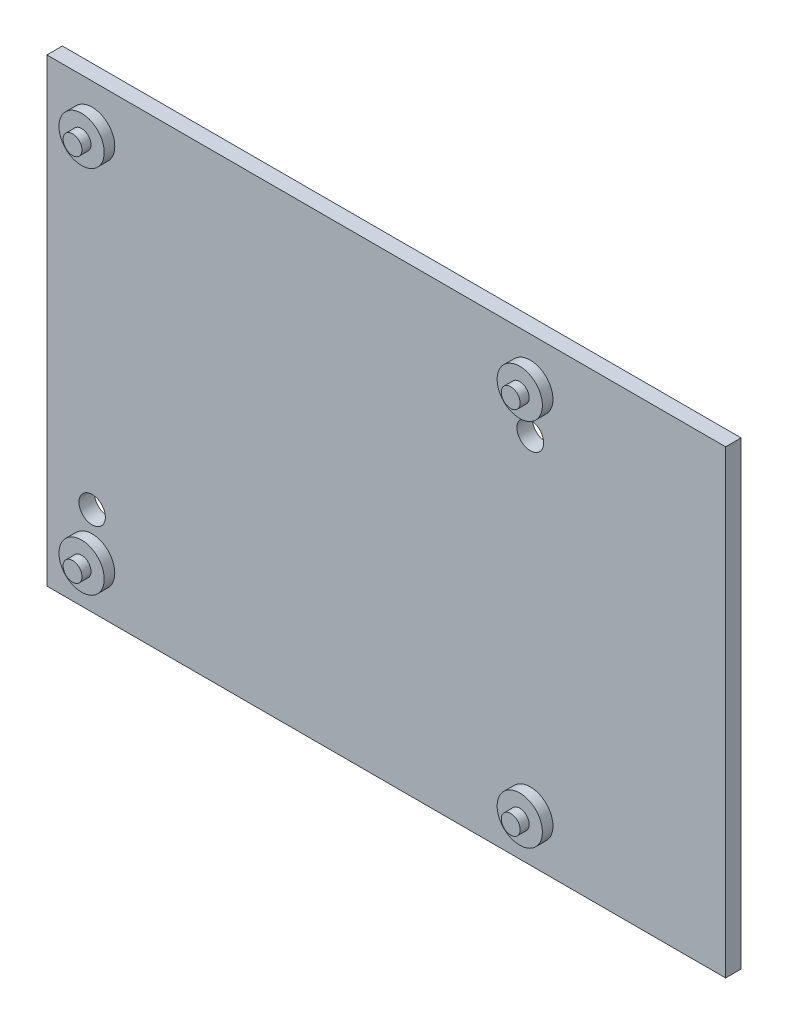
from build123d import *

# Parameters (mm, degrees)
BASE_W                       = 90
BASE_H                       = 61
BASE_BLOCK_DEPTH             = 2.05
OUTER_PIN_STAND_DEPTH        = 1.4
OUTER_PIN_STAND_DEPTH_BACK   = 0.5
OUTER_PIN_R                  = 3
OUTER_PIN_STAND_2_DEPTH      = 1.4
OUTER_PIN_STAND_2_DEPTH_BACK = 0.5
OUTER_PIN_STAND_3_DEPTH      = 1.4
OUTER_PIN_STAND_3_DEPTH_BACK = 0.5
OUTER_PIN_STAND_4_DEPTH      = 1.4
OUTER_PIN_STAND_4_DEPTH_BACK = 0.5
INNER_PIN_STAND_DEPTH        = 2.6
INNER_PIN_STAND_DEPTH_BACK   = 0.5
SKETCH3_R                    = 1.25
INNER_PIN_STAND_2_DEPTH      = 2.6
INNER_PIN_STAND_2_DEPTH_BACK = 0.5
INNER_PIN_STAND_3_DEPTH      = 2.6
INNER_PIN_STAND_3_DEPTH_BACK = 0.5
INNER_PIN_STAND_4_DEPTH      = 2.6
INNER_PIN_STAND_4_DEPTH_BACK = 0.5
HOLES_DEPTH                  = 5
HOLES_DEPTH_BACK             = 5
SKETCH5_R                    = 1.75
HOLES_2_DEPTH                = 5
HOLES_2_DEPTH_BACK           = 5
SKETCH5_R_2                  = 1.775


with BuildPart() as part:
    # Base → Base Block (new body)
    with BuildSketch(Plane.XY):
        Rectangle(BASE_W, BASE_H)
    extrude(amount=-BASE_BLOCK_DEPTH)


with BuildPart() as body_2:
    # Outer Pin → Outer Pin Stand (new, two sides: drawn at the far end of the back side and taken through both)
    with BuildSketch(Plane.XY.offset(-OUTER_PIN_STAND_DEPTH_BACK)):
        with Locations((-39, 24.5)):
            Circle(OUTER_PIN_R)
    extrude(amount=OUTER_PIN_STAND_DEPTH + OUTER_PIN_STAND_DEPTH_BACK)


with BuildPart() as body_3:
    # Outer Pin → Outer Pin Stand 2 (new, two sides: drawn at the far end of the back side and taken through both)
    with BuildSketch(Plane.XY.offset(-OUTER_PIN_STAND_2_DEPTH_BACK)):
        with Locations((-39, -24.5)):
            Circle(OUTER_PIN_R)
    extrude(amount=OUTER_PIN_STAND_2_DEPTH + OUTER_PIN_STAND_2_DEPTH_BACK)


with BuildPart() as body_4:
    # Outer Pin → Outer Pin Stand 3 (new, two sides: drawn at the far end of the back side and taken through both)
    with BuildSketch(Plane.XY.offset(-OUTER_PIN_STAND_3_DEPTH_BACK)):
        with Locations((19.1, -24.5)):
            Circle(OUTER_PIN_R)
    extrude(amount=OUTER_PIN_STAND_3_DEPTH + OUTER_PIN_STAND_3_DEPTH_BACK)


with BuildPart() as body_5:
    # Outer Pin → Outer Pin Stand 4 (new, two sides: drawn at the far end of the back side and taken through both)
    with BuildSketch(Plane.XY.offset(-OUTER_PIN_STAND_4_DEPTH_BACK)):
        with Locations((19.1, 24.5)):
            Circle(OUTER_PIN_R)
    extrude(amount=OUTER_PIN_STAND_4_DEPTH + OUTER_PIN_STAND_4_DEPTH_BACK)


with BuildPart() as body_6:
    # Sketch3 → Inner Pin Stand (new, two sides: drawn at the far end of the back side and taken through both)
    with BuildSketch(Plane.XY.offset(-INNER_PIN_STAND_DEPTH_BACK)):
        with Locations((-39, 24.5)):
            Circle(SKETCH3_R)
    extrude(amount=INNER_PIN_STAND_DEPTH + INNER_PIN_STAND_DEPTH_BACK)


with BuildPart() as body_7:
    # Sketch3 → Inner Pin Stand 2 (new, two sides: drawn at the far end of the back side and taken through both)
    with BuildSketch(Plane.XY.offset(-INNER_PIN_STAND_2_DEPTH_BACK)):
        with Locations((19.1, 24.5)):
            Circle(SKETCH3_R)
    extrude(amount=INNER_PIN_STAND_2_DEPTH + INNER_PIN_STAND_2_DEPTH_BACK)


with BuildPart() as body_8:
    # Sketch3 → Inner Pin Stand 3 (new, two sides: drawn at the far end of the back side and taken through both)
    with BuildSketch(Plane.XY.offset(-INNER_PIN_STAND_3_DEPTH_BACK)):
        with Locations((19.1, -24.5)):
            Circle(SKETCH3_R)
    extrude(amount=INNER_PIN_STAND_3_DEPTH + INNER_PIN_STAND_3_DEPTH_BACK)


with BuildPart() as body_9:
    # Sketch3 → Inner Pin Stand 4 (new, two sides: drawn at the far end of the back side and taken through both)
    with BuildSketch(Plane.XY.offset(-INNER_PIN_STAND_4_DEPTH_BACK)):
        with Locations((-39, -24.5)):
            Circle(SKETCH3_R)
    extrude(amount=INNER_PIN_STAND_4_DEPTH + INNER_PIN_STAND_4_DEPTH_BACK)


with BuildPart() as body_10:
    # Sketch5 → Holes (new, two sides: drawn at the far end of the back side and taken through both)
    with BuildSketch(Plane.XY.offset(-HOLES_DEPTH_BACK)):
        with Locations((-39, -18.72)):
            Circle(SKETCH5_R)
    extrude(amount=HOLES_DEPTH + HOLES_DEPTH_BACK)


with BuildPart() as body_11:
    # Sketch5 → Holes 2 (new, two sides: drawn at the far end of the back side and taken through both)
    with BuildSketch(Plane.XY.offset(-HOLES_2_DEPTH_BACK)):
        with Locations((19.1, 18.86871886)):
            Circle(SKETCH5_R_2)
    extrude(amount=HOLES_2_DEPTH + HOLES_2_DEPTH_BACK)


with BuildPart() as part_1:
    add(part.part)

    # Combine1: union body 2, body 6, body 5, body 7, body 4, body 8, body 3, body 9
    add(body_2.part)
    add(body_6.part)
    add(body_5.part)
    add(body_7.part)
    add(body_4.part)
    add(body_8.part)
    add(body_3.part)
    add(body_9.part)

    # Combine2: cut body 11, body 10
    add(body_11.part, mode=Mode.SUBTRACT)
    add(body_10.part, mode=Mode.SUBTRACT)


solid = part_1.part
